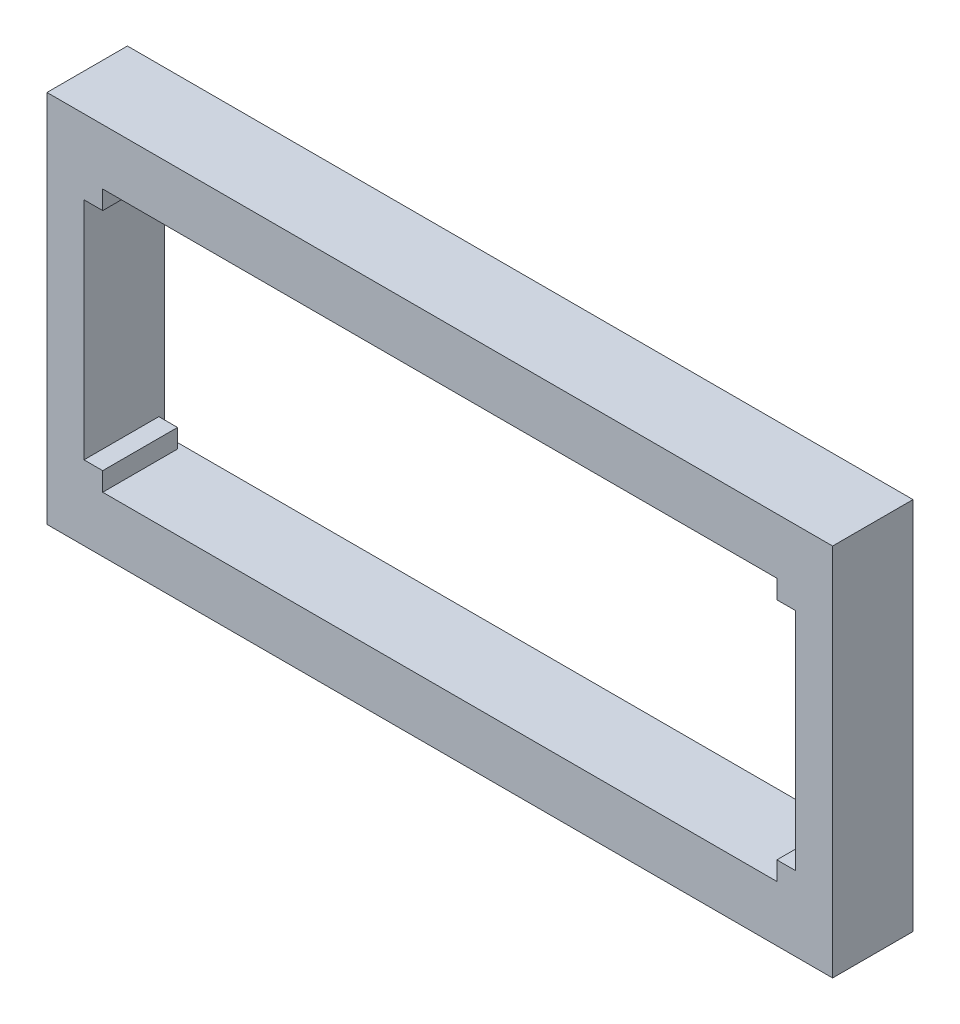
from build123d import *

# Parameters (mm, degrees)
SKETCH1_W           = 210
SKETCH1_H           = 100
SKETCH1_W_2         = 190.2
SKETCH1_H_2         = 70.2
BOSS_EXTRUDE1_DEPTH = 1.5
SKETCH2_W           = 210
SKETCH2_H           = 100
SKETCH2_W_2         = 5
SKETCH2_H_2         = 5
BOSS_EXTRUDE2_DEPTH = 20


with BuildPart() as part:
    # Sketch1 → Boss-Extrude1 (new body)
    with BuildSketch(Plane.XY):
        with Locations((95.1, 35.1)):
            Rectangle(SKETCH1_W, SKETCH1_H)
        with Locations((95.1, 35.1)):
            Rectangle(SKETCH1_W_2, SKETCH1_H_2, mode=Mode.SUBTRACT)
    extrude(amount=BOSS_EXTRUDE1_DEPTH)

    # Sketch2 → Boss-Extrude2 (add)
    # profile 1 of 5: a face of its own
    with BuildSketch(Plane.XY.offset(1.5)):
        with Locations((95.1, 35.1)):
            Rectangle(SKETCH2_W, SKETCH2_H)
        Polygon((0, 65.2), (0, 70.2), (5, 70.2), (185.2, 70.2), (190.2, 70.2), (190.2, 65.2), (190.2, 5), (190.2, 0), (185.2, 0), (5, 0), (0, 0), (0, 5), align=None, mode=Mode.SUBTRACT)
    # profile 2 of 5: a face of its own
    with BuildSketch(Plane.XY.offset(1.5)):
        with Locations((2.5, 67.7)):
            Rectangle(SKETCH2_W_2, SKETCH2_H_2)
    # profile 3 of 5: a face of its own
    with BuildSketch(Plane.XY.offset(1.5)):
        with Locations((2.5, 2.5)):
            Rectangle(SKETCH2_W_2, SKETCH2_H_2)
    # profile 4 of 5: a face of its own
    with BuildSketch(Plane.XY.offset(1.5)):
        with Locations((187.7, 67.7)):
            Rectangle(SKETCH2_W_2, SKETCH2_H_2)
    # profile 5 of 5: a face of its own
    with BuildSketch(Plane.XY.offset(1.5)):
        with Locations((187.7, 2.5)):
            Rectangle(SKETCH2_W_2, SKETCH2_H_2)
    extrude(amount=BOSS_EXTRUDE2_DEPTH)


solid = part.part
